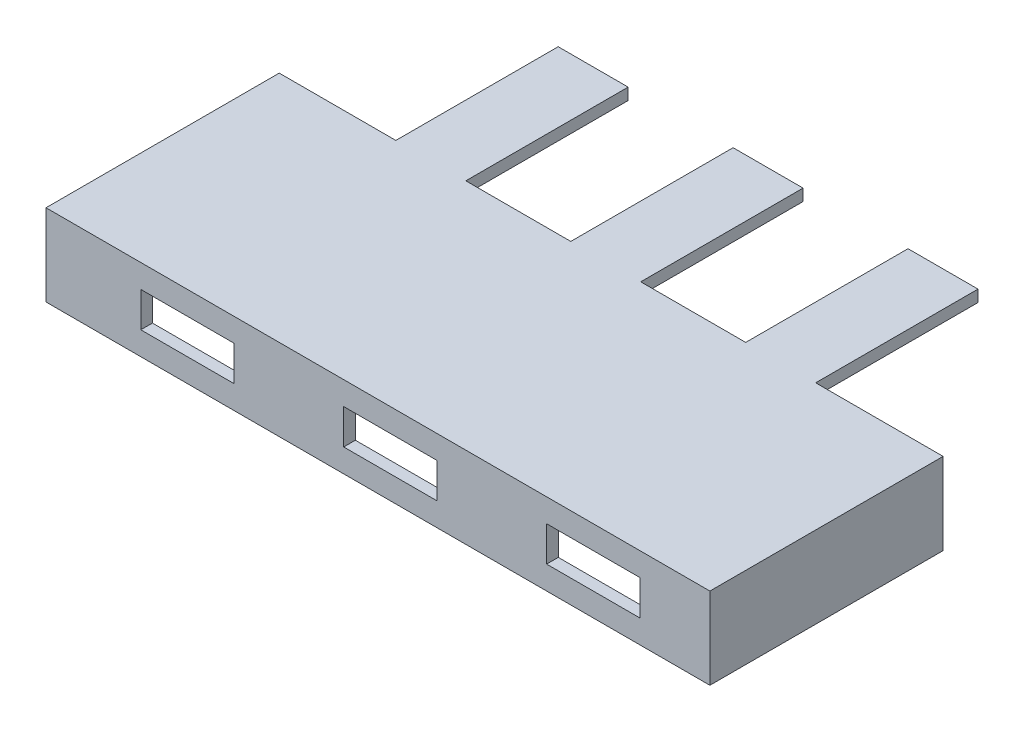
from build123d import *

# Parameters (mm, degrees)
EXTRUDE_1_DEPTH     = 5
SKETCH_4_W          = 20
SKETCH_4_H          = 20
SKETCH_4_W_2        = 10
SKETCH_4_H_2        = 10
EXTRUDE_2_DEPTH     = 35
SKETCH_5_W          = 244.874710442
SKETCH_5_H          = 5
SKETCH_5_W_2        = 5
SKETCH_5_H_2        = 60
EXTRUDE_3_DEPTH     = 30
SKETCH_7_W          = 40
SKETCH_7_H          = 15
CUT_EXTRUDE_2_DEPTH = 5


with BuildPart() as part:
    # 草图2 → 凸台-拉伸1 (new body)
    with BuildSketch(Plane(origin=(0, 0, 0), x_dir=(1, 0, 0), z_dir=(0, 1, 0))):
        Polygon((-232.515561992, 29.211958859), (-232.515561992, -40.383972047), (-282.515561992, -40.383972047), (-282.515561992, -140.383972047), (2.125454159, -140.383972047), (2.125454159, -40.383972047), (-52.515561992, -40.383972047), (-52.515561992, 29.211958859), (-82.515561992, 29.211958859), (-82.515561992, -40.383972047), (-127.515561992, -40.383972047), (-127.515561992, 29.211958859), (-157.515561992, 29.211958859), (-157.515561992, -40.383972047), (-202.515561992, -40.383972047), (-202.515561992, 29.211958859), align=None)
    extrude(amount=EXTRUDE_1_DEPTH)

    # 草图4 → 凸台-拉伸2 (add)
    # profile 1 of 4: a face of its own
    with BuildSketch(Plane(origin=(0, 5, 0), x_dir=(1, 0, 0), z_dir=(0, 1, 0))):
        with Locations((-272.515561992, -50.383972047)):
            Rectangle(SKETCH_4_W, SKETCH_4_H)
        with Locations((-272.515561992, -50.383972047)):
            Rectangle(SKETCH_4_W_2, SKETCH_4_H_2, mode=Mode.SUBTRACT)
    # profile 2 of 4: a face of its own
    with BuildSketch(Plane(origin=(0, 5, 0), x_dir=(1, 0, 0), z_dir=(0, 1, 0))):
        with Locations((-272.515561992, -130.383972047)):
            Rectangle(SKETCH_4_W, SKETCH_4_H)
        with Locations((-272.515561992, -130.383972047)):
            Rectangle(SKETCH_4_W_2, SKETCH_4_H_2, mode=Mode.SUBTRACT)
    # profile 3 of 4: a face of its own
    with BuildSketch(Plane(origin=(0, 5, 0), x_dir=(1, 0, 0), z_dir=(0, 1, 0))):
        with Locations((-7.874545841, -50.383972047)):
            Rectangle(SKETCH_4_W, SKETCH_4_H)
        with Locations((-7.874545841, -50.383972047)):
            Rectangle(SKETCH_4_W_2, SKETCH_4_H_2, mode=Mode.SUBTRACT)
    # profile 4 of 4: a face of its own
    with BuildSketch(Plane(origin=(0, 5, 0), x_dir=(1, 0, 0), z_dir=(0, 1, 0))):
        with Locations((-7.874545841, -130.383972047)):
            Rectangle(SKETCH_4_W, SKETCH_4_H)
        with Locations((-7.874545841, -130.383972047)):
            Rectangle(SKETCH_4_W_2, SKETCH_4_H_2, mode=Mode.SUBTRACT)
    extrude(amount=-EXTRUDE_2_DEPTH)

    # 草图5 → 凸台-拉伸3 (add)
    with BuildSketch(Plane.XZ):
        with Locations((-140.311901062, 137.883972047)):
            Rectangle(SKETCH_5_W, SKETCH_5_H)
        with Locations((-280.015561992, 90.383972047)):
            Rectangle(SKETCH_5_W_2, SKETCH_5_H_2)
        with Locations((-0.374545841, 90.383972047)):
            Rectangle(SKETCH_5_W_2, SKETCH_5_H_2)
    extrude(amount=EXTRUDE_3_DEPTH)

    # 草图7 → 切除-拉伸2 (cut)
    with BuildSketch(Plane.XY.offset(140.383972047)):
        with Locations((-134.874545841, -12.5)):
            Rectangle(SKETCH_7_W, SKETCH_7_H)
        with Locations((-47.874545841, -12.5)):
            Rectangle(SKETCH_7_W, SKETCH_7_H)
        with Locations((-221.874545841, -12.5)):
            Rectangle(SKETCH_7_W, SKETCH_7_H)
    extrude(amount=-CUT_EXTRUDE_2_DEPTH, mode=Mode.SUBTRACT)


solid = part.part
